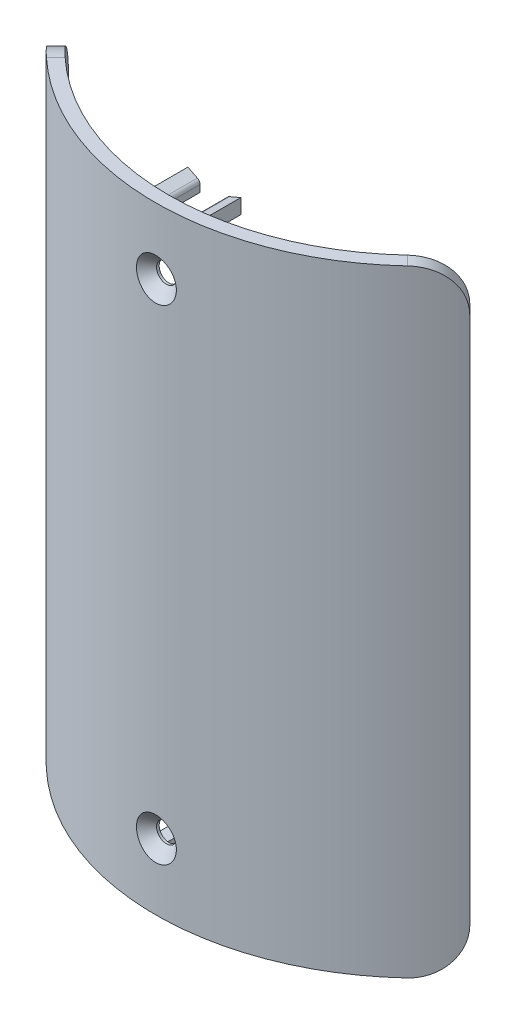
from build123d import *

# Parameters (mm, degrees)
BOSS_EXTRUDE1_DEPTH                                 = 70
BOSS_EXTRUDE2_REACH                                 = 115.806
BOSS_EXTRUDE2_START_RADIUS                          = 57
BOSS_EXTRUDE2_END_RADIUS                            = 57
SKETCH7_W                                           = 3
SKETCH7_H                                           = 10
CSK_FOR_M4_COUNTERSUNK_FLAT_HEAD_SCREW2_D           = 4.5
CSK_FOR_M4_COUNTERSUNK_FLAT_HEAD_SCREW2_DEPTH       = 11.5
CSK_FOR_M4_COUNTERSUNK_FLAT_HEAD_SCREW2_CSINK_D     = 9.4
CSK_FOR_M4_COUNTERSUNK_FLAT_HEAD_SCREW2_CSINK_ANGLE = 90
CSK_FOR_M4_COUNTERSUNK_FLAT_HEAD_SCREW2_TIP         = 1.351936393
FILLET1_R                                           = 10


with BuildPart() as part:
    # Sketch2 → Boss-Extrude1 (new, symmetric)
    with BuildSketch(Plane(origin=(0, 0, 0), x_dir=(1, 0, 0), z_dir=(0, 1, 0))):
        with BuildLine():
            Line((-47.704446333, -36.390737834), (-45.562994128, -34.249285629))
            ThreePointArc((-45.562994128, -34.249285629), (0, -57), (45.562994128, -34.249285629))
            Line((45.562994128, -34.249285629), (47.704446333, -36.390737834))
            ThreePointArc((47.704446333, -36.390737834), (0, -60), (-47.704446333, -36.390737834))
        make_face()
    extrude(amount=BOSS_EXTRUDE1_DEPTH, both=True)

    # Boss-Extrude2: from a cylinder face, 115.806 long prism both ways, kept between that surface and its translate by the depth
    boss_extrude2_start = Plane(origin=(0, 0.207736, 0), z_dir=(0, -1, 0)) * Cylinder(BOSS_EXTRUDE2_START_RADIUS, 477.027472, mode=Mode.PRIVATE)
    boss_extrude2_end = Plane(origin=(0, 0.207736, -10), z_dir=(0, -1, 0)) * Cylinder(BOSS_EXTRUDE2_END_RADIUS, 477.027472, mode=Mode.PRIVATE)
    # Sketch7 → Boss-Extrude2 (add, from a surface)
    with BuildSketch(Plane.XY, mode=Mode.PRIVATE) as boss_extrude2_sk1:
        with Locations((4.5, -65)):
            Rectangle(SKETCH7_W, SKETCH7_H)
    boss_extrude2_tool1 = extrude(boss_extrude2_sk1.sketch, amount=BOSS_EXTRUDE2_REACH, both=True, mode=Mode.PRIVATE)
    add(((boss_extrude2_tool1 & boss_extrude2_start) - boss_extrude2_end).solids().sort_by_distance((4.5, -65, 51.802164))[0])
    # Sketch7 → Boss-Extrude2 (add, from a surface)
    with BuildSketch(Plane.XY, mode=Mode.PRIVATE) as boss_extrude2_sk2:
        with BuildLine():
            Line((3, 65.553629026), (3, 64))
            Line((3, 64), (6, 64))
            Line((6, 64), (6, 67.370437785))
            Line((6, 67.370437785), (3.649292783, 66.490114182))
            ThreePointArc((3.649292783, 66.490114182), (3.178200993, 66.123406518), (3, 65.553629026))
        make_face()
    boss_extrude2_tool2 = extrude(boss_extrude2_sk2.sketch, amount=BOSS_EXTRUDE2_REACH, both=True, mode=Mode.PRIVATE)
    add(((boss_extrude2_tool2 & boss_extrude2_start) - boss_extrude2_end).solids().sort_by_distance((4.5, -65, 51.802164))[0])
    # Sketch7 → Boss-Extrude2 (add, from a surface)
    with BuildSketch(Plane.XY, mode=Mode.PRIVATE) as boss_extrude2_sk3:
        with BuildLine():
            Line((-3, 65.553629026), (-3, 64))
            Line((-3, 64), (-6, 64))
            Line((-6, 64), (-6, 67.370437785))
            Line((-6, 67.370437785), (-3.649292783, 66.490114182))
            ThreePointArc((-3.649292783, 66.490114182), (-3.178200993, 66.123406518), (-3, 65.553629026))
        make_face()
    boss_extrude2_tool3 = extrude(boss_extrude2_sk3.sketch, amount=BOSS_EXTRUDE2_REACH, both=True, mode=Mode.PRIVATE)
    add(((boss_extrude2_tool3 & boss_extrude2_start) - boss_extrude2_end).solids().sort_by_distance((4.5, -65, 51.802164))[0])
    # Sketch7 → Boss-Extrude2 (add, from a surface)
    with BuildSketch(Plane.XY, mode=Mode.PRIVATE) as boss_extrude2_sk4:
        with Locations((-4.5, -65)):
            Rectangle(SKETCH7_W, SKETCH7_H)
    boss_extrude2_tool4 = extrude(boss_extrude2_sk4.sketch, amount=BOSS_EXTRUDE2_REACH, both=True, mode=Mode.PRIVATE)
    add(((boss_extrude2_tool4 & boss_extrude2_start) - boss_extrude2_end).solids().sort_by_distance((4.5, -65, 51.802164))[0])

    # CSK for M4 Countersunk Flat Head Screw2
    with Locations(Plane(origin=(0, 55, 60), x_dir=(1, 0, 0), z_dir=(0, 0, 1))):
        with Locations((0, 0), (0, -110)):
            CounterSinkHole(CSK_FOR_M4_COUNTERSUNK_FLAT_HEAD_SCREW2_D / 2, CSK_FOR_M4_COUNTERSUNK_FLAT_HEAD_SCREW2_CSINK_D / 2, depth=CSK_FOR_M4_COUNTERSUNK_FLAT_HEAD_SCREW2_DEPTH, counter_sink_angle=CSK_FOR_M4_COUNTERSUNK_FLAT_HEAD_SCREW2_CSINK_ANGLE)
            with Locations((0, 0, -(CSK_FOR_M4_COUNTERSUNK_FLAT_HEAD_SCREW2_DEPTH + CSK_FOR_M4_COUNTERSUNK_FLAT_HEAD_SCREW2_TIP / 2))):  # 118° drill point
                Cone(0, CSK_FOR_M4_COUNTERSUNK_FLAT_HEAD_SCREW2_D / 2, CSK_FOR_M4_COUNTERSUNK_FLAT_HEAD_SCREW2_TIP, mode=Mode.SUBTRACT)

    # Fillet1
    fillet1_edges = [part.edges().sort_by_distance(p)[0] for p in [
        (-46.63372023, 70, 35.320011731),
        (-46.63372023, -70, 35.320011731),
        (46.63372023, -70, 35.320011731),
        (46.63372023, 70, 35.320011731),
    ]]
    fillet(fillet1_edges, radius=FILLET1_R)


solid = part.part
